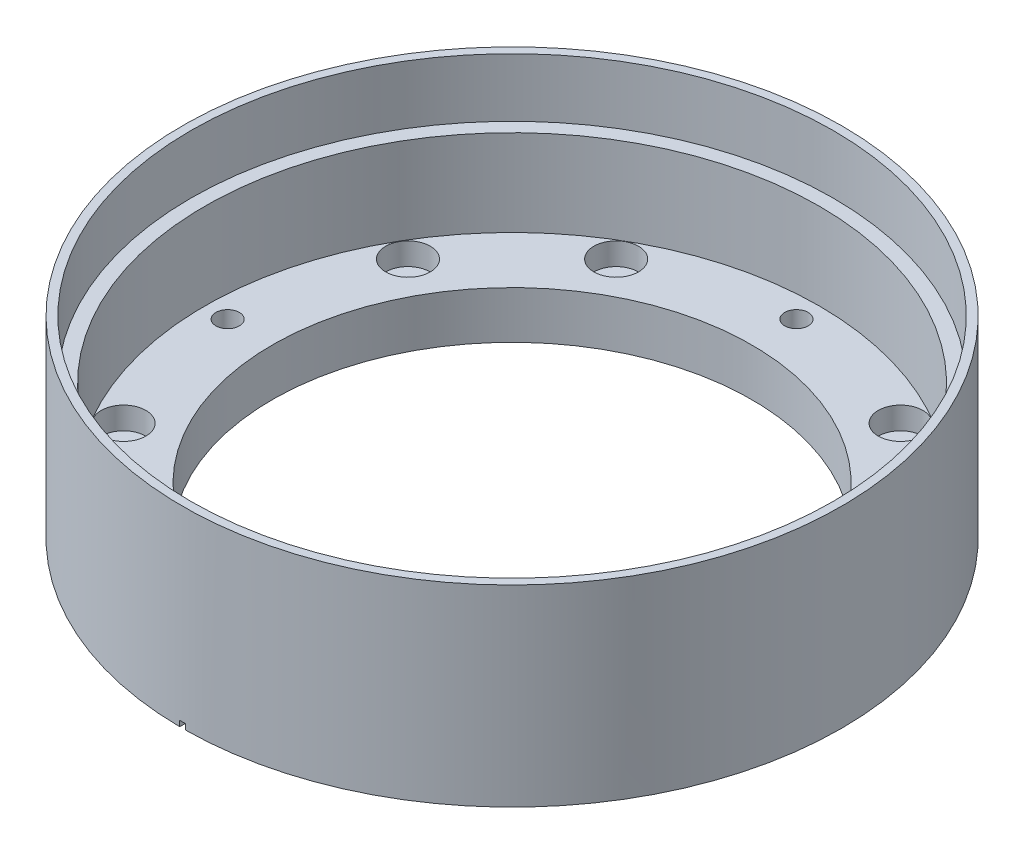
from build123d import *

# Parameters (mm, degrees)
SKETCH_1_R           = 59.5
EXTRUDE_1_DEPTH      = 34.5
SKETCH_2_R           = 57.6
CUT_EXTRUDE_1_DEPTH  = 10.5
SKETCH_3_R           = 55.1
CUT_EXTRUDE_2_DEPTH  = 15.5
SKETCH_4_R           = 43
CUT_EXTRUDE_3_DEPTH  = 89.07099409
SKETCH_9_R           = 4
CUT_EXTRUDE_7_DEPTH  = 4
SKETCH_10_R          = 2.1
CUT_EXTRUDE_8_DEPTH  = 89.07099409
SKETCH_11_R          = 3.75
CUT_EXTRUDE_9_DEPTH  = 5
SKETCH_14_R          = 59.5
SKETCH_14_R_2        = 59.1
CUT_EXTRUDE_12_DEPTH = 91.94366388
CUT_EXTRUDE_13_DEPTH = 1


with BuildPart() as part:
    # 草图1 → 凸台-拉伸1 (new body)
    with BuildSketch(Plane(origin=(0, 0, 0), x_dir=(1, 0, 0), z_dir=(0, 1, 0))):
        with Locations(Location((0, 0, 0), (0, 0, 270))):
            Circle(SKETCH_1_R)
    extrude(amount=EXTRUDE_1_DEPTH)

    # 草图2 → 切除-拉伸1 (cut)
    with BuildSketch(Plane(origin=(0, 34.5, 0), x_dir=(1, 0, 0), z_dir=(0, 1, 0))):
        with Locations(Location((0, 0, 0), (0, 0, 270))):
            Circle(SKETCH_2_R)
    extrude(amount=-CUT_EXTRUDE_1_DEPTH, mode=Mode.SUBTRACT)

    # 草图3 → 切除-拉伸2 (cut)
    with BuildSketch(Plane(origin=(0, 24, 0), x_dir=(1, 0, 0), z_dir=(0, 1, 0))):
        with Locations(Location((0, 0, 0), (0, 0, 270))):
            Circle(SKETCH_3_R)
    extrude(amount=-CUT_EXTRUDE_2_DEPTH, mode=Mode.SUBTRACT)

    # 草图4 → 切除-拉伸3 (cut, through all)
    with BuildSketch(Plane(origin=(0, 8.5, 0), x_dir=(1, 0, 0), z_dir=(0, 1, 0))):
        with Locations(Location((0, 0, 0), (0, 0, 270))):
            Circle(SKETCH_4_R)
    extrude(amount=-CUT_EXTRUDE_3_DEPTH, mode=Mode.SUBTRACT)

    # 草图9 → 切除-拉伸7 (cut)
    with BuildSketch(Plane(origin=(0, 8.5, 0), x_dir=(1, 0, 0), z_dir=(0, 1, 0))):
        with Locations(Location((-44.167295593, 25.5, 0), (0, 0, 270))):
            Circle(SKETCH_9_R)
        with Locations(Location((-25.5, 44.167295593, 0), (0, 0, 270))):
            Circle(SKETCH_9_R)
        with Locations(Location((25.5, 44.167295593, 0), (0, 0, 270))):
            Circle(SKETCH_9_R)
        with Locations(Location((44.167295593, 25.5, 0), (0, 0, 270))):
            Circle(SKETCH_9_R)
        with Locations(Location((44.167295593, -25.5, 0), (0, 0, 270))):
            Circle(SKETCH_9_R)
        with Locations(Location((25.5, -44.167295593, 0), (0, 0, 270))):
            Circle(SKETCH_9_R)
        with Locations(Location((-25.5, -44.167295593, 0), (0, 0, 270))):
            Circle(SKETCH_9_R)
        with Locations(Location((-44.167295593, -25.5, 0), (0, 0, 270))):
            Circle(SKETCH_9_R)
    extrude(amount=-CUT_EXTRUDE_7_DEPTH, mode=Mode.SUBTRACT)

    # 草图10 → 切除-拉伸8 (cut, through all)
    with BuildSketch(Plane(origin=(0, 8.5, 0), x_dir=(1, 0, 0), z_dir=(0, 1, 0))):
        with Locations(Location((0, 51, 0), (0, 0, 270))):
            Circle(SKETCH_10_R)
        with Locations(Location((51, 0, 0), (0, 0, 270))):
            Circle(SKETCH_10_R)
        with Locations(Location((0, -51, 0), (0, 0, 270))):
            Circle(SKETCH_10_R)
        with Locations(Location((-51, 0, 0), (0, 0, 270))):
            Circle(SKETCH_10_R)
    extrude(amount=-CUT_EXTRUDE_8_DEPTH, mode=Mode.SUBTRACT)

    # 草图11 → 切除-拉伸9 (cut)
    with BuildSketch(Plane.XZ):
        with Locations(Location((0, 51, 0), (0, 0, 270))):
            Circle(SKETCH_11_R)
        with Locations(Location((51, 0, 0), (0, 0, 270))):
            Circle(SKETCH_11_R)
        with Locations(Location((0, -51, 0), (0, 0, 270))):
            Circle(SKETCH_11_R)
        with Locations(Location((-51, 0, 0), (0, 0, 270))):
            Circle(SKETCH_11_R)
    extrude(amount=-CUT_EXTRUDE_9_DEPTH, mode=Mode.SUBTRACT)

    # 草图14 → 切除-拉伸12 (cut, through all)
    with BuildSketch(Plane.XZ):
        Circle(SKETCH_14_R)
        with Locations(Location((0, 0, 0), (0, 0, 270))):
            Circle(SKETCH_14_R_2, mode=Mode.SUBTRACT)
    extrude(amount=-CUT_EXTRUDE_12_DEPTH, mode=Mode.SUBTRACT)

    # 草图15 → 切除-拉伸13 (cut)
    with BuildSketch(Plane.XZ):
        Polygon((0, -59.1), (0.5, -59.1), (0.5, -58.1), (-0.5, -58.1), (-0.5, -59.1), align=None)
        Polygon((0.5, 59.1), (0.5, 58.1), (-0.5, 58.1), (-0.5, 59.1), (0, 59.1), align=None)
    extrude(amount=-CUT_EXTRUDE_13_DEPTH, mode=Mode.SUBTRACT)


solid = part.part
